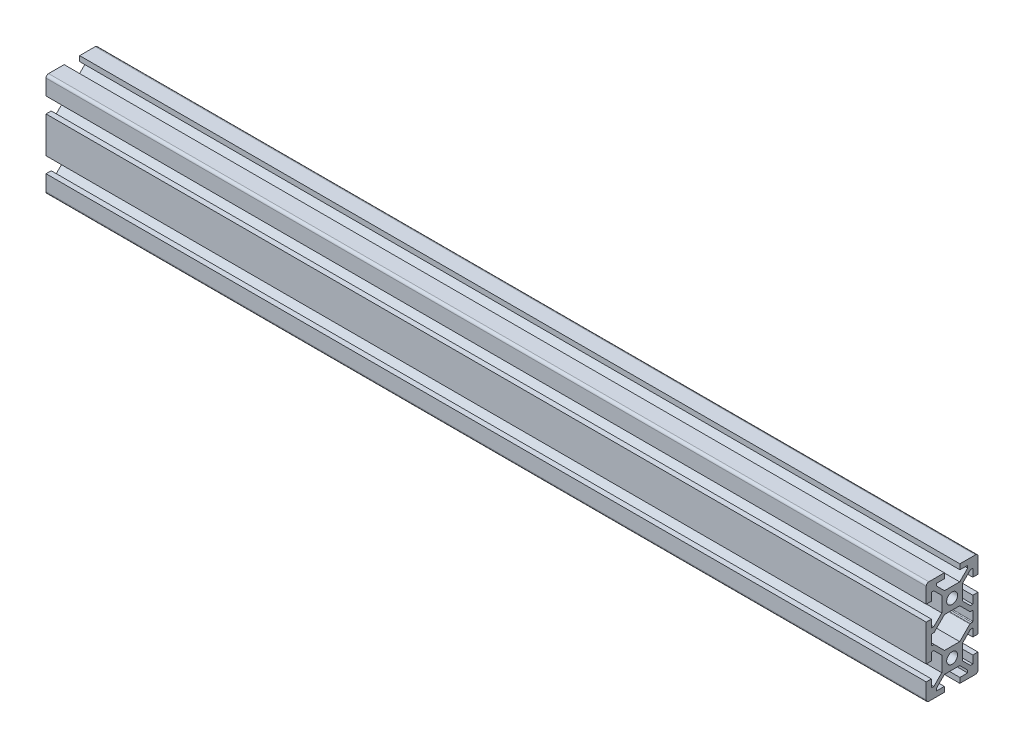
from build123d import *

# Parameters (mm, degrees)
SKETCH1_R           = 2.1
BOSS_EXTRUDE1_DEPTH = 340


with BuildPart() as part:
    # Sketch1 → Boss-Extrude1 (new body)
    with BuildSketch(Plane(origin=(0, 0, 0), x_dir=(0, 0, -1), z_dir=(1, 0, 0))):
        with BuildLine():
            Line((-10, -13), (-10, -19))
            ThreePointArc((-10, -19), (-9.707106781, -19.707106781), (-9, -20))
            Line((-9, -20), (-3, -20))
            Line((-3, -20), (-3, -18))
            Line((-3, -18), (-6, -18))
            Line((-6, -18), (-6, -17.060660172))
            Line((-6, -17.060660172), (-2.939339828, -14))
            Line((-2.939339828, -14), (2.939339828, -14))
            Line((2.939339828, -14), (6, -17.060660172))
            Line((6, -17.060660172), (6, -18))
            Line((6, -18), (3, -18))
            Line((3, -18), (3, -20))
            Line((3, -20), (9, -20))
            ThreePointArc((9, -20), (9.707106781, -19.707106781), (10, -19))
            Line((10, -19), (10, -13))
            Line((10, -13), (8, -13))
            Line((8, -13), (8, -16))
            Line((8, -16), (7.060660172, -16))
            Line((7.060660172, -16), (4, -12.939339828))
            Line((4, -12.939339828), (4, -7.060660172))
            Line((4, -7.060660172), (7.060660172, -4))
            Line((7.060660172, -4), (8, -4))
            Line((8, -4), (8, -7))
            Line((8, -7), (10, -7))
            Line((10, -7), (10, 7))
            Line((10, 7), (8, 7))
            Line((8, 7), (8, 4))
            Line((8, 4), (7.060660172, 4))
            Line((7.060660172, 4), (4, 7.060660172))
            Line((4, 7.060660172), (4, 12.939339828))
            Line((4, 12.939339828), (7.060660172, 16))
            Line((7.060660172, 16), (8, 16))
            Line((8, 16), (8, 13))
            Line((8, 13), (10, 13))
            Line((10, 13), (10, 19))
            ThreePointArc((10, 19), (9.707106781, 19.707106781), (9, 20))
            Line((9, 20), (3, 20))
            Line((3, 20), (3, 18))
            Line((3, 18), (6, 18))
            Line((6, 18), (6, 17.060660172))
            Line((6, 17.060660172), (2.939339828, 14))
            Line((2.939339828, 14), (-2.939339828, 14))
            Line((-2.939339828, 14), (-6, 17.060660172))
            Line((-6, 17.060660172), (-6, 18))
            Line((-6, 18), (-3, 18))
            Line((-3, 18), (-3, 20))
            Line((-3, 20), (-9, 20))
            ThreePointArc((-9, 20), (-9.707106781, 19.707106781), (-10, 19))
            Line((-10, 19), (-10, 13))
            Line((-10, 13), (-8, 13))
            Line((-8, 13), (-8, 16))
            Line((-8, 16), (-7.060660172, 16))
            Line((-7.060660172, 16), (-4, 12.939339828))
            Line((-4, 12.939339828), (-4, 7.060660172))
            Line((-4, 7.060660172), (-7.060660172, 4))
            Line((-7.060660172, 4), (-8, 4))
            Line((-8, 4), (-8, 7))
            Line((-8, 7), (-10, 7))
            Line((-10, 7), (-10, -7))
            Line((-10, -7), (-8, -7))
            Line((-8, -7), (-8, -4))
            Line((-8, -4), (-7.060660172, -4))
            Line((-7.060660172, -4), (-4, -7.060660172))
            Line((-4, -7.060660172), (-4, -12.939339828))
            Line((-4, -12.939339828), (-7.060660172, -16))
            Line((-7.060660172, -16), (-8, -16))
            Line((-8, -16), (-8, -13))
            Line((-8, -13), (-10, -13))
        make_face()
        with Locations((0, 10)):
            Circle(SKETCH1_R, mode=Mode.SUBTRACT)
        with Locations((0, -10)):
            Circle(SKETCH1_R, mode=Mode.SUBTRACT)
        with BuildLine():
            Line((-8, 1.7), (-8, -1.7))
            ThreePointArc((-8, -1.7), (-7.912132034, -1.912132034), (-7.7, -2))
            Line((-7.7, -2), (-7.063603897, -2))
            ThreePointArc((-7.063603897, -2), (-6.948798867, -2.02283614), (-6.851471863, -2.087867966))
            Line((-6.851471863, -2.087867966), (-2.939339828, -6))
            Line((-2.939339828, -6), (2.939339828, -6))
            Line((2.939339828, -6), (6.851471863, -2.087867966))
            ThreePointArc((6.851471863, -2.087867966), (6.948798867, -2.02283614), (7.063603897, -2))
            Line((7.063603897, -2), (7.7, -2))
            ThreePointArc((7.7, -2), (7.912132034, -1.912132034), (8, -1.7))
            Line((8, -1.7), (8, 1.7))
            ThreePointArc((8, 1.7), (7.912132034, 1.912132034), (7.7, 2))
            Line((7.7, 2), (7.063603897, 2))
            ThreePointArc((7.063603897, 2), (6.948798867, 2.02283614), (6.851471863, 2.087867966))
            Line((6.851471863, 2.087867966), (2.939339828, 6))
            Line((2.939339828, 6), (-2.939339828, 6))
            Line((-2.939339828, 6), (-6.851471863, 2.087867966))
            ThreePointArc((-6.851471863, 2.087867966), (-6.948798867, 2.02283614), (-7.063603897, 2))
            Line((-7.063603897, 2), (-7.7, 2))
            ThreePointArc((-7.7, 2), (-7.912132034, 1.912132034), (-8, 1.7))
        make_face(mode=Mode.SUBTRACT)
    extrude(amount=BOSS_EXTRUDE1_DEPTH)


solid = part.part
